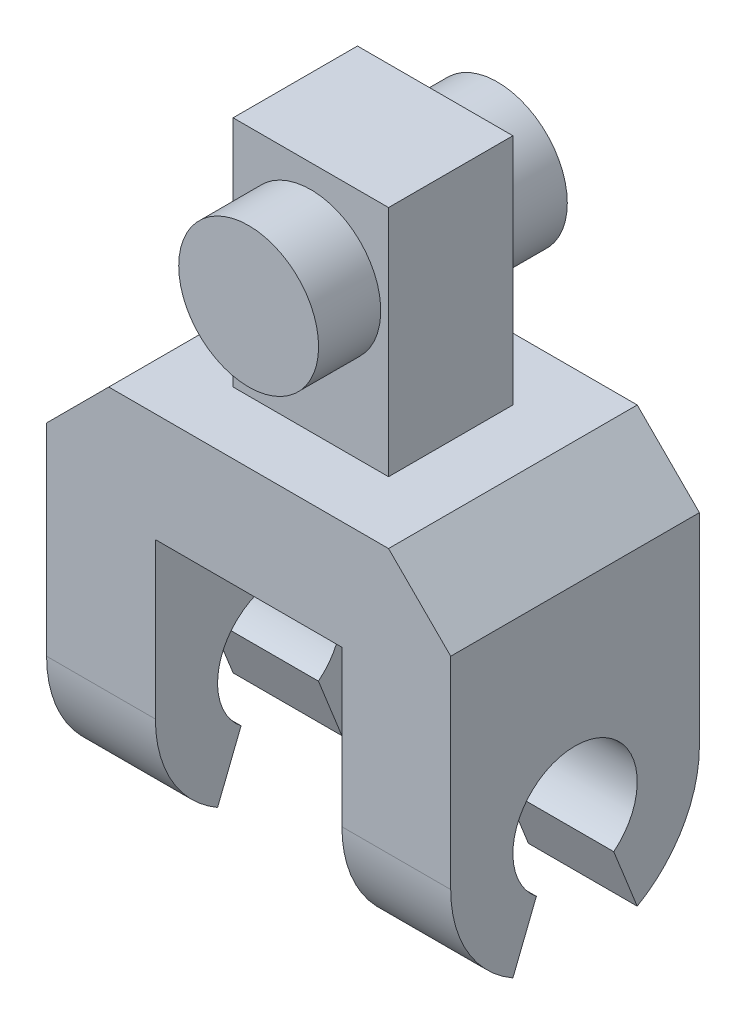
from build123d import *

# Parameters (mm, degrees)
BOSS_EXTRUDE1_START = 6
SKETCH1_R           = 4
BOSS_EXTRUDE1_DEPTH = 7
BOSS_EXTRUDE2_START = -6
SKETCH1_2_R         = 4
BOSS_EXTRUDE2_DEPTH = 7
SKETCH2_W           = 26
SKETCH2_H           = 16
BOSS_EXTRUDE3_DEPTH = 7
CHAMFER1_SIZE       = 4
SKETCH3_W           = 10
SKETCH3_H           = 8
BOSS_EXTRUDE4_DEPTH = 15
SKETCH5_R           = 4.5
BOSS_EXTRUDE5_DEPTH = 8
CUT_EXTRUDE1_REACH  = 44


with BuildPart() as part:
    # Sketch1 → Boss-Extrude1 (new body)
    with BuildSketch(Plane(origin=(0, 0, 0), x_dir=(0, 0, -1), z_dir=(1, 0, 0)).offset(BOSS_EXTRUDE1_START)):
        with BuildLine():
            Line((-8, 0), (-8, 10))
            Line((-8, 10), (8, 10))
            Line((8, 10), (8, 0))
            ThreePointArc((8, 0), (0, -8), (-8, 0))
        make_face()
        Circle(SKETCH1_R, mode=Mode.SUBTRACT)
    extrude(amount=BOSS_EXTRUDE1_DEPTH)



with BuildPart() as body_2:
    # Sketch1<2> → Boss-Extrude2 (new body)
    with BuildSketch(Plane(origin=(0, 0, 0), x_dir=(0, 0, -1), z_dir=(1, 0, 0)).offset(BOSS_EXTRUDE2_START)):
        with BuildLine():
            Line((-8, 0), (-8, 10))
            Line((-8, 10), (8, 10))
            Line((8, 10), (8, 0))
            ThreePointArc((8, 0), (0, -8), (-8, 0))
        make_face()
        Circle(SKETCH1_2_R, mode=Mode.SUBTRACT)
    extrude(amount=-BOSS_EXTRUDE2_DEPTH)


with BuildPart() as part_1:
    add(part.part)

    add(body_2.part)  # Boss-Extrude3 merges body 2
    # Sketch2 → Boss-Extrude3 (add)
    with BuildSketch(Plane(origin=(0, 10, 0), x_dir=(1, 0, 0), z_dir=(0, 1, 0))):
        Rectangle(SKETCH2_W, SKETCH2_H)
    extrude(amount=BOSS_EXTRUDE3_DEPTH)

    # Chamfer1
    chamfer1_edges = [part_1.edges().sort_by_distance(p)[0] for p in [
        (-13, 17, 0),
        (13, 17, 0),
    ]]
    chamfer(chamfer1_edges, length=CHAMFER1_SIZE)

    # Sketch3 → Boss-Extrude4 (add)
    with BuildSketch(Plane(origin=(0, 17, 0), x_dir=(1, 0, 0), z_dir=(0, 1, 0))):
        Rectangle(SKETCH3_W, SKETCH3_H)
    extrude(amount=BOSS_EXTRUDE4_DEPTH)

    # Sketch5 → Boss-Extrude5 (add, symmetric)
    with BuildSketch(Plane.XY):
        with Locations(Location((0, 26, 0), (0, 0, 180))):
            Circle(SKETCH5_R)
    extrude(amount=BOSS_EXTRUDE5_DEPTH, both=True)

    # Cut-Extrude1: up to this face of the body (flat: up to its plane)
    cut_extrude1_end = Plane(part_1.part.faces().sort_by_distance((13, 6.5, 7.735992424))[0])
    # Sketch6 → Cut-Extrude1 (cut, up to the picked face)
    with BuildSketch(Plane.ZY.offset(13), mode=Mode.PRIVATE) as cut_extrude1_sk1:
        with BuildLine():
            Line((-2.488370132, -3.13177491), (-4, -6.92820323))
            ThreePointArc((-4, -6.92820323), (0, -8), (4, -6.92820323))
            Line((4, -6.92820323), (2.488370132, -3.13177491))
            ThreePointArc((2.488370132, -3.13177491), (0, -4), (-2.488370132, -3.13177491))
        make_face()
    cut_extrude1_tool1 = split(extrude(cut_extrude1_sk1.sketch, amount=-CUT_EXTRUDE1_REACH, mode=Mode.PRIVATE), bisect_by=cut_extrude1_end, keep=Keep.BOTH, mode=Mode.PRIVATE)
    add(cut_extrude1_tool1.solids().sort_by(Axis((-13, -5.819668, 0), (1, 0, 0)))[0], mode=Mode.SUBTRACT)


solid = part_1.part
